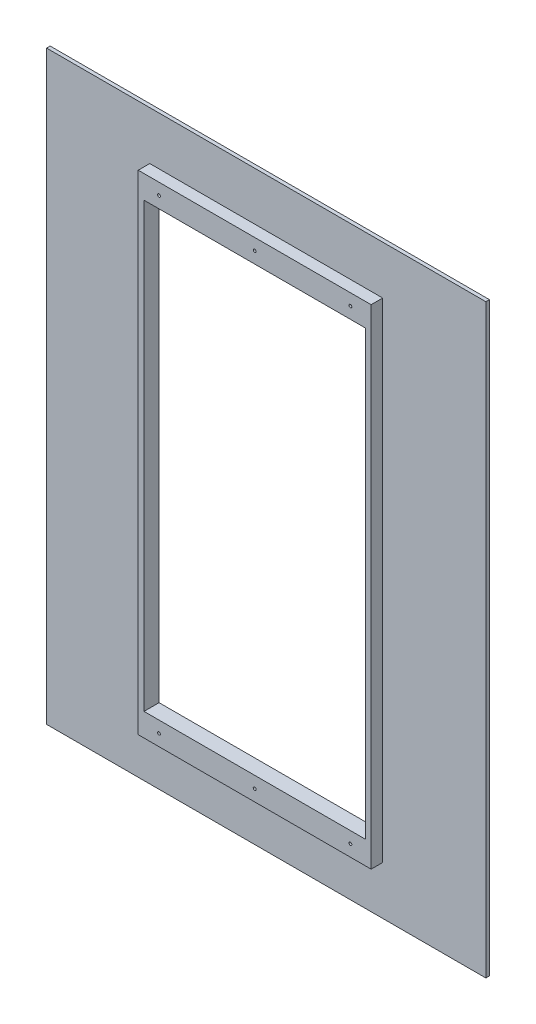
from build123d import *

# Parameters (mm, degrees)
SKETCH1_W           = 381
SKETCH1_H           = 508
SKETCH1_W_2         = 192
SKETCH1_H_2         = 384
BOSS_EXTRUDE1_DEPTH = 13.1
SKETCH11_R          = 1.25
CUT_EXTRUDE4_DEPTH  = 10
SKETCH12_R          = 1.25
CUT_EXTRUDE5_DEPTH  = 10
SKETCH19_R          = 1.25
CUT_EXTRUDE6_DEPTH  = 10
SKETCH20_W          = 89.5
SKETCH20_H          = 508
CUT_EXTRUDE7_DEPTH  = 10
SKETCH21_W          = 202
SKETCH21_H          = 42
CUT_EXTRUDE8_DEPTH  = 10


with BuildPart() as part:
    # Sketch1 → Boss-Extrude1 (new body)
    with BuildSketch(Plane.XY):
        with Locations((190.5, 254)):
            Rectangle(SKETCH1_W, SKETCH1_H)
        with Locations((190.5, 254)):
            Rectangle(SKETCH1_W_2, SKETCH1_H_2, mode=Mode.SUBTRACT)
    extrude(amount=BOSS_EXTRUDE1_DEPTH)

    # Sketch11 → Cut-Extrude4 (cut)
    with BuildSketch(Plane.XY.offset(13.1)):
        with Locations((107.5, 456)):
            Circle(SKETCH11_R)
    extrude(amount=-CUT_EXTRUDE4_DEPTH, mode=Mode.SUBTRACT)

    # Sketch12 → Cut-Extrude5 (cut)
    with BuildSketch(Plane.XY.offset(13.1)):
        with Locations((273.5, 456)):
            Circle(SKETCH12_R)
        with Locations((107.5, 52)):
            Circle(SKETCH12_R)
        with Locations((273.5, 52)):
            Circle(SKETCH12_R)
    extrude(amount=-CUT_EXTRUDE5_DEPTH, mode=Mode.SUBTRACT)

    # Sketch19 → Cut-Extrude6 (cut)
    with BuildSketch(Plane.XY.offset(13.1)):
        with Locations((190.5, 456)):
            Circle(SKETCH19_R)
        with Locations((190.5, 52)):
            Circle(SKETCH19_R)
    extrude(amount=-CUT_EXTRUDE6_DEPTH, mode=Mode.SUBTRACT)

    # Sketch20 → Cut-Extrude7 (cut)
    with BuildSketch(Plane.XY.offset(13.1)):
        with Locations((44.75, 254)):
            Rectangle(SKETCH20_W, SKETCH20_H)
        with Locations((336.25, 254)):
            Rectangle(SKETCH20_W, SKETCH20_H)
    extrude(amount=-CUT_EXTRUDE7_DEPTH, mode=Mode.SUBTRACT)

    # Sketch21 → Cut-Extrude8 (cut)
    with BuildSketch(Plane.XY.offset(13.1)):
        with Locations((190.5, 487)):
            Rectangle(SKETCH21_W, SKETCH21_H)
        with Locations((190.5, 21)):
            Rectangle(SKETCH21_W, SKETCH21_H)
    extrude(amount=-CUT_EXTRUDE8_DEPTH, mode=Mode.SUBTRACT)


solid = part.part
